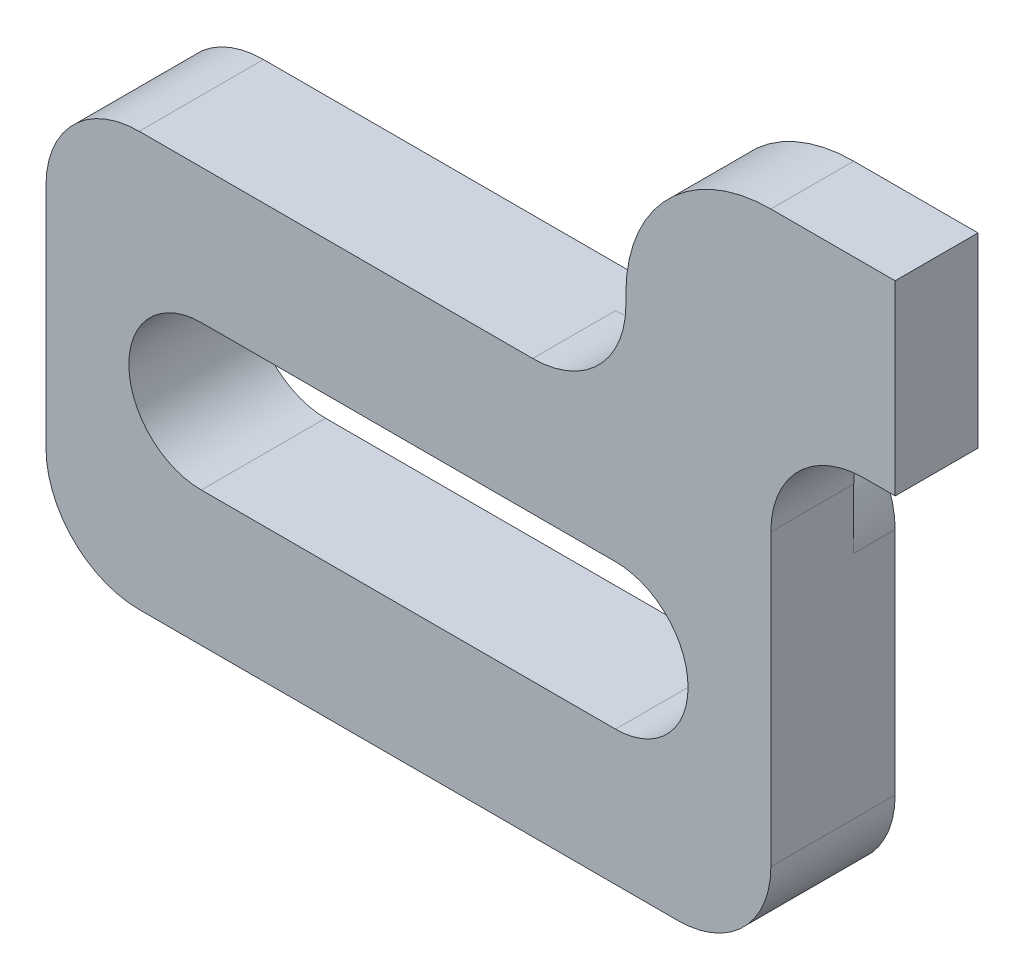
from build123d import *

# Parameters (mm, degrees)
AUFSATZ_LINEAR_AUSTRAGEN1_DEPTH = 3
SCHNITT_LINEAR_AUSTRAGEN1_DEPTH = 1
SCHNITT_LINEAR_AUSTRAGEN2_DEPTH = 1


with BuildPart() as part:
    # Skizze1 → Aufsatz-Linear austragen1 (new body)
    with BuildSketch(Plane.XY):
        with BuildLine():
            Line((2.25, 0), (15.25, 0))
            ThreePointArc((15.25, 0), (16.840990258, 0.659009742), (17.5, 2.25))
            Line((17.5, 2.25), (17.5, 9.25))
            ThreePointArc((17.5, 9.25), (18.159009742, 10.840990258), (19.75, 11.5))
            Line((19.75, 11.5), (20.5, 11.5))
            Line((20.5, 11.5), (20.5, 16))
            Line((20.5, 16), (17.5, 16))
            ThreePointArc((17.5, 16), (15.025126266, 14.974873734), (14, 12.5))
            Line((14, 12.5), (14, 12.25))
            ThreePointArc((14, 12.25), (13.340990258, 10.659009742), (11.75, 10))
            Line((11.75, 10), (2.25, 10))
            ThreePointArc((2.25, 10), (0.659009742, 9.340990258), (0, 7.75))
            Line((0, 7.75), (0, 2.25))
            ThreePointArc((0, 2.25), (0.659009742, 0.659009742), (2.25, 0))
        make_face()
        with BuildLine():
            Line((3.75, 6.75), (13.75, 6.75))
            ThreePointArc((13.75, 6.75), (15.5, 5), (13.75, 3.25))
            Line((13.75, 3.25), (3.75, 3.25))
            ThreePointArc((3.75, 3.25), (2, 5), (3.75, 6.75))
        make_face(mode=Mode.SUBTRACT)
    extrude(amount=AUFSATZ_LINEAR_AUSTRAGEN1_DEPTH)

    # Skizze2 → Schnitt-Linear austragen1 (cut)
    with BuildSketch(Plane(origin=(0, 0, 0), x_dir=(-1, 0, 0), z_dir=(0, 0, -1))):
        Polygon((0.473585846, 10), (-20.5, 10), (-20.5, 11.5), (-20.5, 17.5), (0.473585846, 17.5), (0.473585846, 12.5), align=None)
    extrude(amount=-SCHNITT_LINEAR_AUSTRAGEN1_DEPTH, mode=Mode.SUBTRACT)

    # Skizze3 → Schnitt-Linear austragen2 (cut)
    with BuildSketch(Plane(origin=(0, 0, 0), x_dir=(-1, 0, 0), z_dir=(0, 0, -1))):
        with BuildLine():
            Line((-17.5, 7.8), (-18.826048275, 7.8))
            Line((-18.826048275, 7.8), (-18.826048275, 10.648235291))
            Line((-18.826048275, 10.648235291), (-15.3, 10.648235291))
            Line((-15.3, 10.648235291), (-15.3, 10))
            ThreePointArc((-15.3, 10), (-16.855634919, 9.355634919), (-17.5, 7.8))
        make_face()
    extrude(amount=-SCHNITT_LINEAR_AUSTRAGEN2_DEPTH, mode=Mode.SUBTRACT)


solid = part.part
